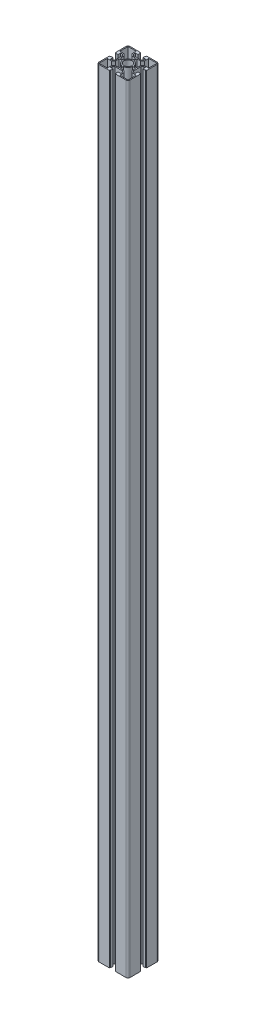
from build123d import *

# Parameters (mm, degrees)
SKETCH_1_R      = 8
EXTRUDE_1_DEPTH = 1500


with BuildPart() as part:
    # 草图1 → 凸台-拉伸1 (new body)
    with BuildSketch(Plane(origin=(0, 0, 0), x_dir=(1, 0, 0), z_dir=(0, 1, 0))):
        with BuildLine():
            Line((-30, 5.999999999), (-28.5, 5.999999999))
            Line((-28.5, 5.999999999), (-28.5, 4.999999999))
            Line((-28.5, 4.999999999), (-24, 4.999999999))
            Line((-24, 4.999999999), (-24, 9.999999999))
            Line((-24, 9.999999999), (-21, 9.999999999))
            Line((-21, 9.999999999), (-18, 6.999999999))
            Line((-18, 6.999999999), (-18, -7.000000001))
            Line((-18, -7.000000001), (-21, -10.000000001))
            Line((-21, -10.000000001), (-24, -10.000000001))
            Line((-24, -10.000000001), (-24, -5.000000001))
            Line((-24, -5.000000001), (-28.5, -5.000000001))
            Line((-28.5, -5.000000001), (-28.5, -6.000000001))
            Line((-28.5, -6.000000001), (-30, -6.000000001))
            Line((-30, -6.000000001), (-30, -26.000000001))
            ThreePointArc((-30, -26.000000001), (-28.828427125, -28.828427126), (-26, -30.000000001))
            Line((-26, -30.000000001), (-6, -30.000000001))
            Line((-6, -30.000000001), (-6, -28.500000001))
            Line((-6, -28.500000001), (-5, -28.500000001))
            Line((-5, -28.500000001), (-5, -24.000000001))
            Line((-5, -24.000000001), (-10, -24.000000001))
            Line((-10, -24.000000001), (-10, -21.000000001))
            Line((-10, -21.000000001), (-7, -18.000000001))
            Line((-7, -18.000000001), (7, -18.000000001))
            Line((7, -18.000000001), (10, -21.000000001))
            Line((10, -21.000000001), (10, -24.000000001))
            Line((10, -24.000000001), (5, -24.000000001))
            Line((5, -24.000000001), (5, -28.500000001))
            Line((5, -28.500000001), (6, -28.500000001))
            Line((6, -28.500000001), (6, -30.000000001))
            Line((6, -30.000000001), (26, -30.000000001))
            ThreePointArc((26, -30.000000001), (28.828427125, -28.828427126), (30, -26.000000001))
            Line((30, -26.000000001), (30, -6.000000001))
            Line((30, -6.000000001), (28.5, -6.000000001))
            Line((28.5, -6.000000001), (28.5, -5.000000001))
            Line((28.5, -5.000000001), (24, -5.000000001))
            Line((24, -5.000000001), (24, -10.000000001))
            Line((24, -10.000000001), (21, -10.000000001))
            Line((21, -10.000000001), (18, -7.000000001))
            Line((18, -7.000000001), (18, 6.999999999))
            Line((18, 6.999999999), (21, 9.999999999))
            Line((21, 9.999999999), (24, 9.999999999))
            Line((24, 9.999999999), (24, 4.999999999))
            Line((24, 4.999999999), (28.5, 4.999999999))
            Line((28.5, 4.999999999), (28.5, 5.999999999))
            Line((28.5, 5.999999999), (30, 5.999999999))
            Line((30, 5.999999999), (30, 25.999999999))
            ThreePointArc((30, 25.999999999), (28.828427125, 28.828427124), (26, 29.999999999))
            Line((26, 29.999999999), (6, 29.999999999))
            Line((6, 29.999999999), (6, 28.499999999))
            Line((6, 28.499999999), (5, 28.499999999))
            Line((5, 28.499999999), (5, 23.999999999))
            Line((5, 23.999999999), (10, 23.999999999))
            Line((10, 23.999999999), (10, 20.999999999))
            Line((10, 20.999999999), (7, 17.999999999))
            Line((7, 17.999999999), (-7, 17.999999999))
            Line((-7, 17.999999999), (-10, 20.999999999))
            Line((-10, 20.999999999), (-10, 23.999999999))
            Line((-10, 23.999999999), (-5, 23.999999999))
            Line((-5, 23.999999999), (-5, 28.499999999))
            Line((-5, 28.499999999), (-6, 28.499999999))
            Line((-6, 28.499999999), (-6, 29.999999999))
            Line((-6, 29.999999999), (-26.000000001, 29.999999999))
            ThreePointArc((-26.000000001, 29.999999999), (-28.828427125, 28.828427123), (-30, 25.999999999))
            Line((-30, 25.999999999), (-30, 5.999999999))
        make_face()
        with Locations(Location((0, 0, 0), (0, 0, 270))):
            Circle(SKETCH_1_R, mode=Mode.SUBTRACT)
        with BuildLine():
            Line((-16, 1), (-9.949874371, 1))
            ThreePointArc((-9.949874371, 1), (-7.071067812, 7.071067811), (-1.000000001, 9.949874371))
            Line((-1.000000001, 9.949874371), (-1.000000001, 16))
            Line((-1.000000001, 16), (-7.828427125, 16))
            Line((-7.828427125, 16), (-12, 20.171572875))
            Line((-12, 20.171572875), (-12, 28))
            Line((-12, 28), (-28, 28))
            Line((-28, 28), (-28, 12))
            Line((-28, 12), (-20.171572875, 12))
            Line((-20.171572875, 12), (-16, 7.828427125))
            Line((-16, 7.828427125), (-16, 1))
        make_face(mode=Mode.SUBTRACT)
        with BuildLine():
            Line((1, 9.949874371), (1, 16))
            Line((1, 16), (7.828427125, 16))
            Line((7.828427125, 16), (12, 20.171572875))
            Line((12, 20.171572875), (12, 28))
            Line((12, 28), (28, 28))
            Line((28, 28), (28, 12.000000001))
            Line((28, 12.000000001), (20.171572875, 12.000000001))
            Line((20.171572875, 12.000000001), (16, 7.828427126))
            Line((16, 7.828427126), (16, 1.000000001))
            Line((16, 1.000000001), (9.949874371, 1.000000001))
            ThreePointArc((9.949874371, 1.000000001), (7.071067811, 7.071067812), (1, 9.949874371))
        make_face(mode=Mode.SUBTRACT)
        with BuildLine():
            Line((9.949874371, -1), (16, -1))
            Line((16, -1), (16, -7.828427125))
            Line((16, -7.828427125), (20.171572875, -12))
            Line((20.171572875, -12), (28.000000001, -12))
            Line((28.000000001, -12), (28.000000001, -28))
            Line((28.000000001, -28), (12.000000001, -28))
            Line((12.000000001, -28), (12.000000001, -20.171572875))
            Line((12.000000001, -20.171572875), (7.828427126, -16))
            Line((7.828427126, -16), (1.000000001, -16))
            Line((1.000000001, -16), (1.000000001, -9.949874371))
            ThreePointArc((1.000000001, -9.949874371), (7.071067812, -7.071067811), (9.949874371, -1))
        make_face(mode=Mode.SUBTRACT)
        with BuildLine():
            Line((-1, -9.949874371), (-1, -16.000000001))
            Line((-1, -16.000000001), (-7.828427125, -16.000000001))
            Line((-7.828427125, -16.000000001), (-12, -20.171572876))
            Line((-12, -20.171572876), (-12, -28.000000001))
            Line((-12, -28.000000001), (-28, -28.000000001))
            Line((-28, -28.000000001), (-28, -12.000000001))
            Line((-28, -12.000000001), (-20.171572875, -12.000000001))
            Line((-20.171572875, -12.000000001), (-16, -7.828427126))
            Line((-16, -7.828427126), (-16, -1.000000001))
            Line((-16, -1.000000001), (-9.949874371, -1.000000001))
            ThreePointArc((-9.949874371, -1.000000001), (-7.071067811, -7.071067812), (-1, -9.949874371))
        make_face(mode=Mode.SUBTRACT)
    extrude(amount=EXTRUDE_1_DEPTH)


solid = part.part
